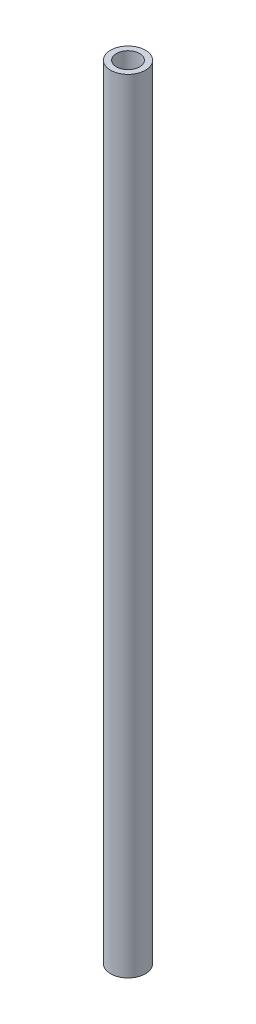
from build123d import *

# Parameters (mm, degrees)
SKETCH1_W = 1
SKETCH1_H = 135


with BuildPart() as part:
    # Sketch1 → Revolve1 (revolve)
    with BuildSketch(Plane.XY, mode=Mode.PRIVATE) as revolve1_sk:
        with Locations((2.5, -32.5)):
            Rectangle(SKETCH1_W, SKETCH1_H)
    revolve(revolve1_sk.sketch.rotate(Axis((0, -200, 0), (0, 1, 0)), 90), axis=Axis((0, -200, 0), (0, 1, 0)))


solid = part.part
